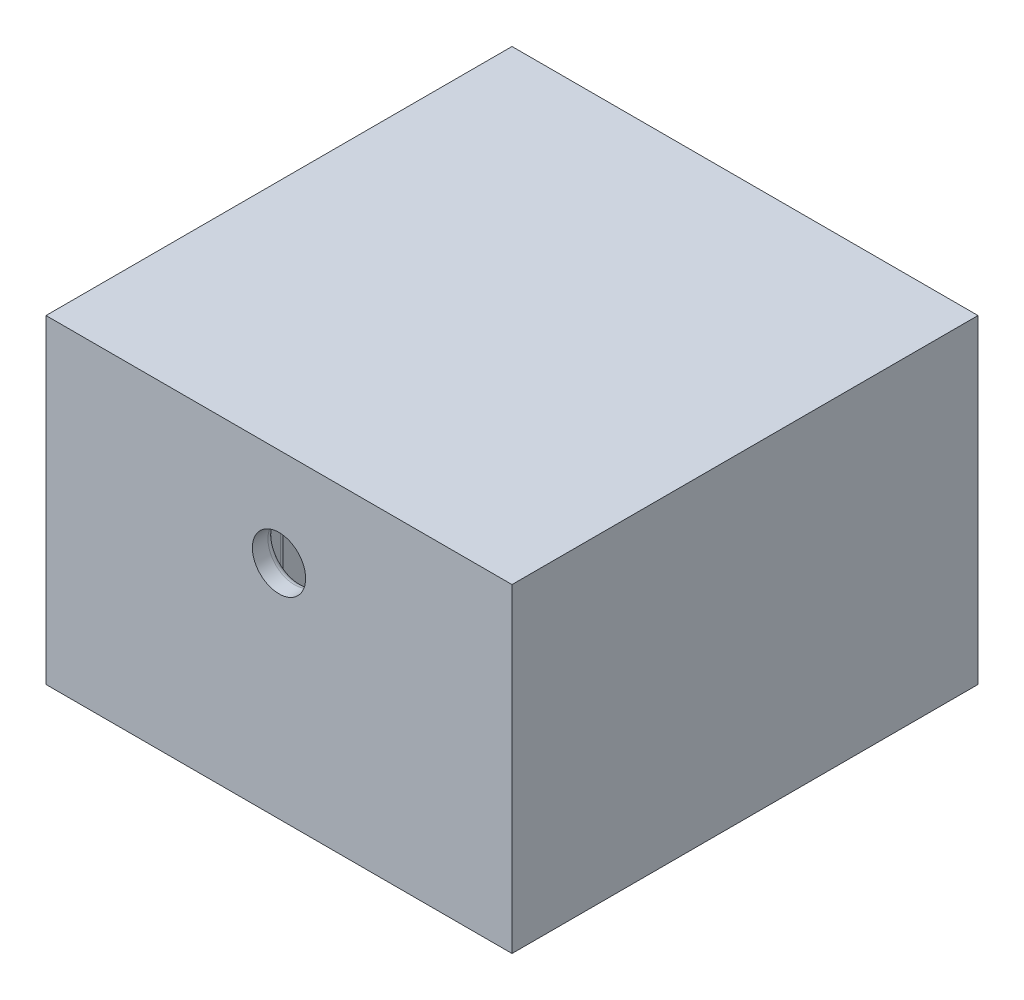
from build123d import *

# Parameters (mm, degrees)
SKETCH1_W           = 70
SKETCH1_H           = 70
BOSS_EXTRUDE1_DEPTH = 42
SKETCH2_W           = 70
SKETCH2_H           = 70
BOSS_EXTRUDE2_DEPTH = 6
SKETCH3_R           = 4
CUT_EXTRUDE1_DEPTH  = 74
SKETCH6_W           = 10.07808718
SKETCH6_H           = 10.120371506
SKETCH6_W_2         = 10.137770901
SKETCH6_H_2         = 10.393985643
BOSS_EXTRUDE4_DEPTH = 28
FILLET1_R           = 1
SKETCH4_R           = 4.2
SKETCH4_R_2         = 3
BOSS_EXTRUDE3_DEPTH = 32
CUT_EXTRUDE2_START  = -28
SKETCH8_R           = 3
CUT_EXTRUDE2_DEPTH  = 28
FILLET2_R           = 1


with BuildPart() as part:
    # Sketch1 → Boss-Extrude1 (new body)
    with BuildSketch(Plane(origin=(0, 0, 0), x_dir=(1, 0, 0), z_dir=(0, 1, 0))):
        with Locations((22.315, -31.66)):
            Rectangle(SKETCH1_W, SKETCH1_H)
        with BuildLine():
            Line((1, 0), (43.63, 0))
            ThreePointArc((43.63, 0), (44.337106781, -0.292893219), (44.63, -1))
            Line((44.63, -1), (44.63, -62.32))
            ThreePointArc((44.63, -62.32), (44.337106781, -63.027106781), (43.63, -63.32))
            Line((43.63, -63.32), (1, -63.32))
            ThreePointArc((1, -63.32), (0.292893219, -63.027106781), (0, -62.32))
            Line((0, -62.32), (0, -1))
            ThreePointArc((0, -1), (0.292893219, -0.292893219), (1, 0))
        make_face(mode=Mode.SUBTRACT)
    extrude(amount=BOSS_EXTRUDE1_DEPTH)

    # Sketch2 → Boss-Extrude2 (add)
    with BuildSketch(Plane(origin=(0, 42, 0), x_dir=(1, 0, 0), z_dir=(0, 1, 0))):
        with Locations((22.315, -31.66)):
            Rectangle(SKETCH2_W, SKETCH2_H)
    extrude(amount=BOSS_EXTRUDE2_DEPTH)

    # Sketch3 → Cut-Extrude1 (cut)
    with BuildSketch(Plane.XY.offset(66.66)):
        with Locations((22.315, 33.289388907)):
            Circle(SKETCH3_R)
    extrude(amount=-CUT_EXTRUDE1_DEPTH, mode=Mode.SUBTRACT)

    # Sketch6 → Boss-Extrude4 (add)
    with BuildSketch(Plane(origin=(0, 42, 0), x_dir=(-1, 0, 0), z_dir=(0, -1, 0))):
        with Locations((-5.03904359, -58.259814247)):
            Rectangle(SKETCH6_W, SKETCH6_H)
        with Locations((-39.56111455, -58.259814247)):
            Rectangle(SKETCH6_W_2, SKETCH6_H)
        with Locations((-39.56111455, -5.196992822)):
            Rectangle(SKETCH6_W_2, SKETCH6_H_2)
        with Locations((-5.03904359, -5.196992822)):
            Rectangle(SKETCH6_W, SKETCH6_H_2)
    extrude(amount=BOSS_EXTRUDE4_DEPTH)

    # Fillet1
    fillet1_edges = [part.edges().sort_by_distance(p)[0] for p in [
        (34.492229099, 28, 10.393985643),
        (10.07808718, 28, 10.393985643),
        (10.07808718, 28, 53.199628494),
        (34.492229099, 28, 53.199628494),
    ]]
    fillet(fillet1_edges, radius=FILLET1_R)

    # Sketch4 → Boss-Extrude3 (add)
    # profile 1 of 4: a face of its own
    with BuildSketch(Plane.XZ.offset(-42)):
        with Locations(Location((5.703606864, 5.703606864, 0), (0, 0, 90))):
            Circle(SKETCH4_R)
        with Locations(Location((5.703606864, 5.703606864, 0), (0, 0, 90))):
            Circle(SKETCH4_R_2, mode=Mode.SUBTRACT)
    # profile 2 of 4: a face of its own
    with BuildSketch(Plane.XZ.offset(-42)):
        with Locations(Location((38.926393136, 5.703606864, 0), (0, 0, 270))):
            Circle(SKETCH4_R)
        with Locations(Location((38.926393136, 5.703606864, 0), (0, 0, 270))):
            Circle(SKETCH4_R_2, mode=Mode.SUBTRACT)
    # profile 3 of 4: a face of its own
    with BuildSketch(Plane.XZ.offset(-42)):
        with Locations(Location((38.926393136, 57.616393136, 0), (0, 0, 90))):
            Circle(SKETCH4_R)
        with Locations(Location((38.926393136, 57.616393136, 0), (0, 0, 90))):
            Circle(SKETCH4_R_2, mode=Mode.SUBTRACT)
    # profile 4 of 4: a face of its own
    with BuildSketch(Plane.XZ.offset(-42)):
        with Locations(Location((5.703606864, 57.616393136, 0), (0, 0, 270))):
            Circle(SKETCH4_R)
        with Locations(Location((5.703606864, 57.616393136, 0), (0, 0, 270))):
            Circle(SKETCH4_R_2, mode=Mode.SUBTRACT)
    extrude(amount=BOSS_EXTRUDE3_DEPTH)

    # Sketch8 → Cut-Extrude2 (cut)
    with BuildSketch(Plane(origin=(0, 14, 0), x_dir=(-1, 0, 0), z_dir=(0, -1, 0)).offset(CUT_EXTRUDE2_START)):
        with Locations(Location((-5.703606864, -57.616393136, 0), (0, 0, 90))):
            Circle(SKETCH8_R)
        with Locations(Location((-38.926393136, -57.616393136, 0), (0, 0, 90))):
            Circle(SKETCH8_R)
        with Locations(Location((-38.926393136, -5.703606864, 0), (0, 0, 90))):
            Circle(SKETCH8_R)
        with Locations(Location((-5.703606864, -5.703606864, 0), (0, 0, 90))):
            Circle(SKETCH8_R)
    extrude(amount=CUT_EXTRUDE2_DEPTH, mode=Mode.SUBTRACT)

    # Fillet2
    fillet2_edges = [part.edges().sort_by_distance(p)[0] for p in [
        (18.315, 33.289388907, 0),
        (18.315, 33.289388907, 63.32),
    ]]
    fillet(fillet2_edges, radius=FILLET2_R)


solid = part.part
